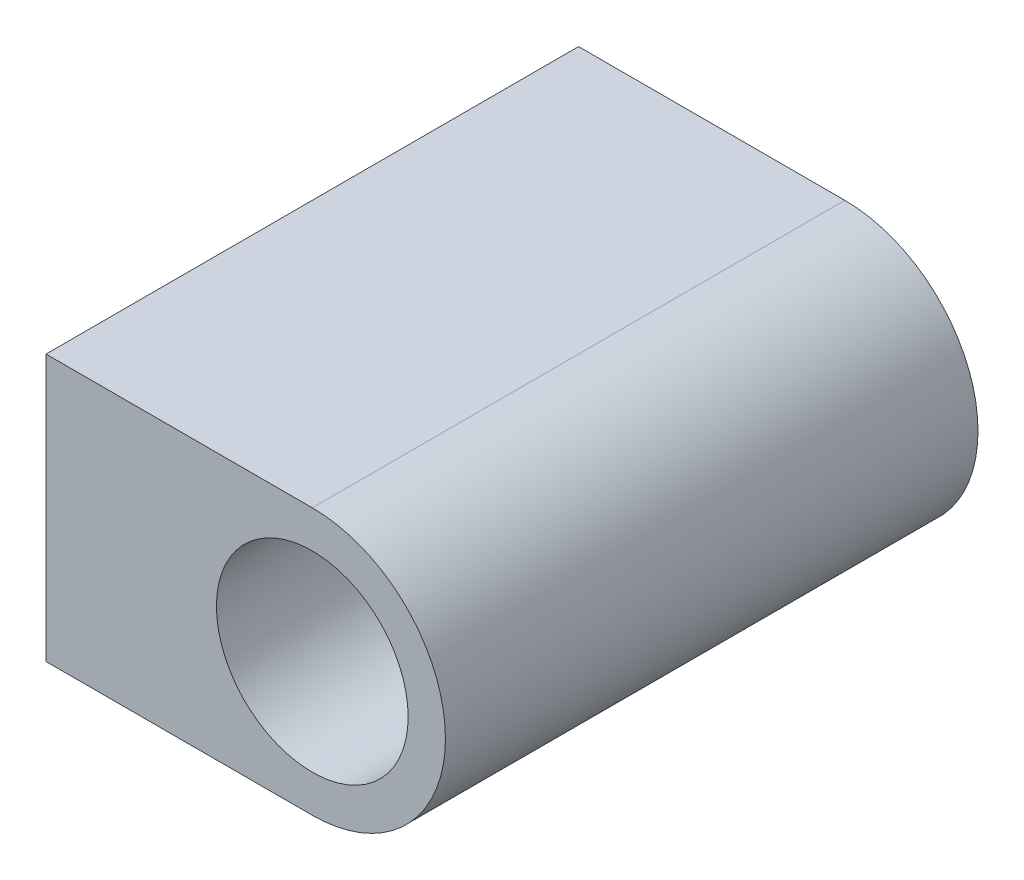
from build123d import *

# Parameters (mm, degrees)
SKETCH_2_R      = 1.8
EXTRUDE_1_DEPTH = 10


with BuildPart() as part:
    # 草图2 → 凸台-拉伸1 (new body)
    with BuildSketch(Plane.XY):
        with BuildLine():
            Line((0, 0), (-5, 0))
            Line((-5, 0), (-5, -5))
            Line((-5, -5), (0, -5))
            ThreePointArc((0, -5), (2.5, -2.5), (0, 0))
        make_face()
        with Locations((0, -2.5)):
            Circle(SKETCH_2_R, mode=Mode.SUBTRACT)
    extrude(amount=EXTRUDE_1_DEPTH)


solid = part.part
